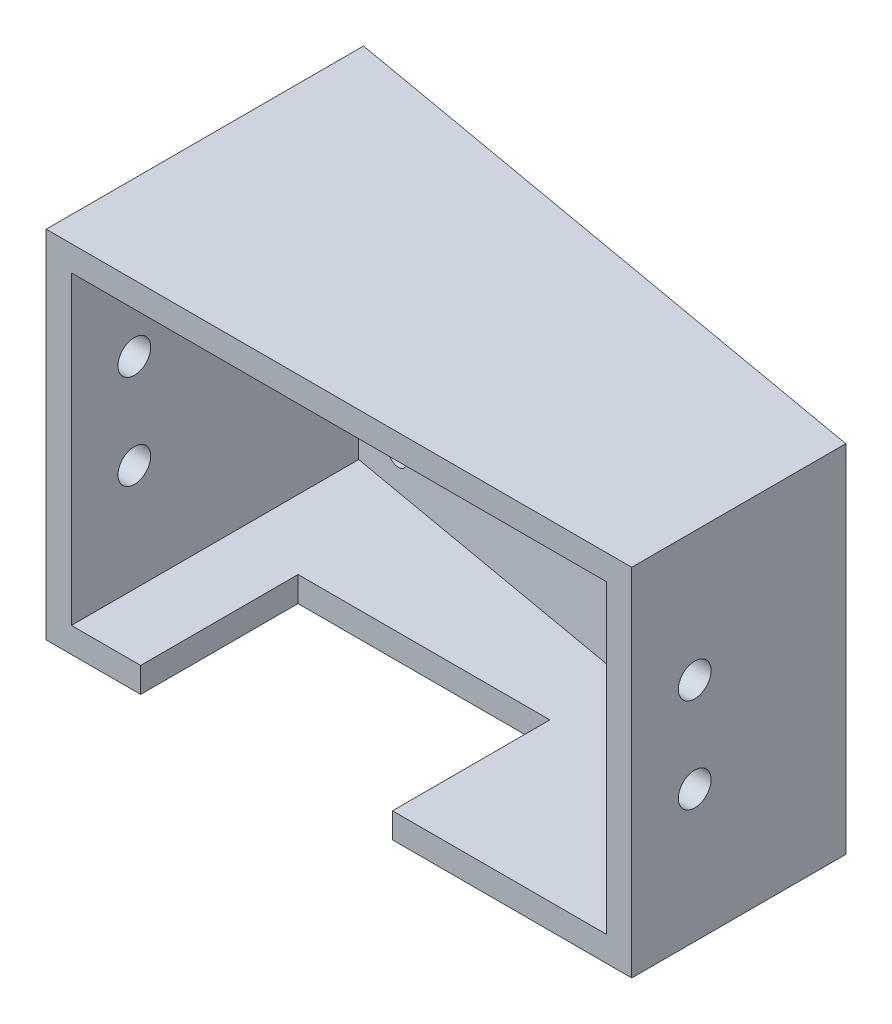
from build123d import *

# Parameters (mm, degrees)
BOSS_EXTRUDE1_DEPTH = 5.08
BOSS_EXTRUDE2_DEPTH = 61.595
BOSS_EXTRUDE3_DEPTH = 5.08
SKETCH4_R           = 3.302
CUT_EXTRUDE1_DEPTH  = 150.974308337
SKETCH5_R           = 2.667
CUT_EXTRUDE2_DEPTH  = 5.08


with BuildPart() as part:
    # Sketch1 → Boss-Extrude1 (new body)
    with BuildSketch(Plane(origin=(0, 0, 0), x_dir=(1, 0, 0), z_dir=(0, 1, 0))):
        Polygon((0, 64.005979691), (0, 43.18), (0, 0), (118.11, 0), (118.11, 43.18), align=None)
    extrude(amount=BOSS_EXTRUDE1_DEPTH)

    # Sketch2 → Boss-Extrude2 (add)
    with BuildSketch(Plane.XZ):
        Polygon((5.08, -5.08), (5.08, -57.951871441), (113.03, -38.917373874), (113.03, -5.08), (113.03, 0), (118.11, 0), (118.11, -43.18), (0, -64.005979691), (0, 0), (5.08, 0), align=None)
    extrude(amount=BOSS_EXTRUDE2_DEPTH)

    # Sketch3 → Boss-Extrude3 (add)
    with BuildSketch(Plane.XZ.offset(61.595)):
        Polygon((113.03, 0), (69.85, 0), (69.85, -31.75), (19.05, -31.75), (19.05, 0), (5.08, 0), (5.08, -57.951871441), (113.03, -38.917373874), align=None)
        Polygon((0, -64.005979691), (118.11, -43.18), (118.11, 0), (113.03, 0), (113.03, -38.917373874), (5.08, -57.951871441), (5.08, 0), (0, 0), align=None)
    extrude(amount=BOSS_EXTRUDE3_DEPTH)

    # Sketch4 → Cut-Extrude1 (cut, through all)
    with BuildSketch(Plane.ZY):
        with Locations((-12.7, -20.955)):
            Circle(SKETCH4_R)
        with Locations((-12.7, -40.005)):
            Circle(SKETCH4_R)
    extrude(amount=-CUT_EXTRUDE1_DEPTH, mode=Mode.SUBTRACT)

    # Sketch5 → Cut-Extrude2 (cut)
    with BuildSketch(Plane(origin=(10.945667174, 0, -62.075963247), x_dir=(-0.9848077530122081, 0, -0.17364817766693075), z_dir=(0.17364817766693075, 0, -0.9848077530122081))):
        with Locations(Location((-93.301496832, -6.985, 0), (0, 0, 180))):
            Circle(SKETCH5_R)
        with Locations((-93.301496832, -54.61)):
            Circle(SKETCH5_R)
        with Locations((-4.401496832, -6.985)):
            Circle(SKETCH5_R)
        with Locations(Location((-4.401496832, -54.61, 0), (0, 0, 180))):
            Circle(SKETCH5_R)
    extrude(amount=-CUT_EXTRUDE2_DEPTH, mode=Mode.SUBTRACT)


solid = part.part
